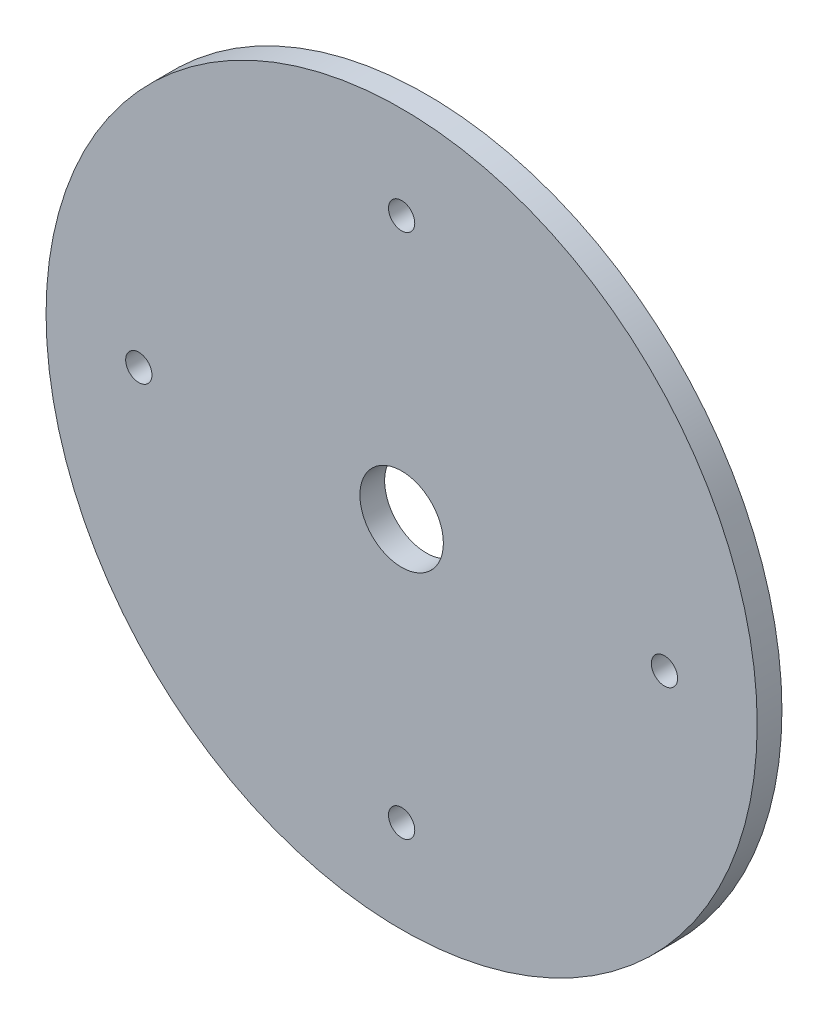
from build123d import *

# Parameters (mm, degrees)
SKETCH1_R           = 115
BOSS_EXTRUDE1_DEPTH = 8
SKETCH2_R           = 4.25
CUT_EXTRUDE1_DEPTH  = 28
SKETCH3_R           = 4.25
CUT_EXTRUDE2_DEPTH  = 28
SKETCH4_R           = 4.25
CUT_EXTRUDE3_DEPTH  = 28
SKETCH5_R           = 4.25
CUT_EXTRUDE4_DEPTH  = 28
SKETCH6_R           = 13.5
CUT_EXTRUDE5_DEPTH  = 28


with BuildPart() as part:
    # Sketch1 → Boss-Extrude1 (new body)
    with BuildSketch(Plane.XY.offset(462)):
        with Locations((300, 300)):
            Circle(SKETCH1_R)
    extrude(amount=BOSS_EXTRUDE1_DEPTH)

    # Sketch2 → Cut-Extrude1 (cut)
    with BuildSketch(Plane.XY.offset(470)):
        with Locations((385, 300)):
            Circle(SKETCH2_R)
    extrude(amount=-CUT_EXTRUDE1_DEPTH, mode=Mode.SUBTRACT)

    # Sketch3 → Cut-Extrude2 (cut)
    with BuildSketch(Plane.XY.offset(470)):
        with Locations((215, 300)):
            Circle(SKETCH3_R)
    extrude(amount=-CUT_EXTRUDE2_DEPTH, mode=Mode.SUBTRACT)

    # Sketch4 → Cut-Extrude3 (cut)
    with BuildSketch(Plane.XY.offset(470)):
        with Locations((300, 385)):
            Circle(SKETCH4_R)
    extrude(amount=-CUT_EXTRUDE3_DEPTH, mode=Mode.SUBTRACT)

    # Sketch5 → Cut-Extrude4 (cut)
    with BuildSketch(Plane.XY.offset(470)):
        with Locations((300, 215)):
            Circle(SKETCH5_R)
    extrude(amount=-CUT_EXTRUDE4_DEPTH, mode=Mode.SUBTRACT)

    # Sketch6 → Cut-Extrude5 (cut)
    with BuildSketch(Plane.XY.offset(470)):
        with Locations((300, 300)):
            Circle(SKETCH6_R)
    extrude(amount=-CUT_EXTRUDE5_DEPTH, mode=Mode.SUBTRACT)


solid = part.part
